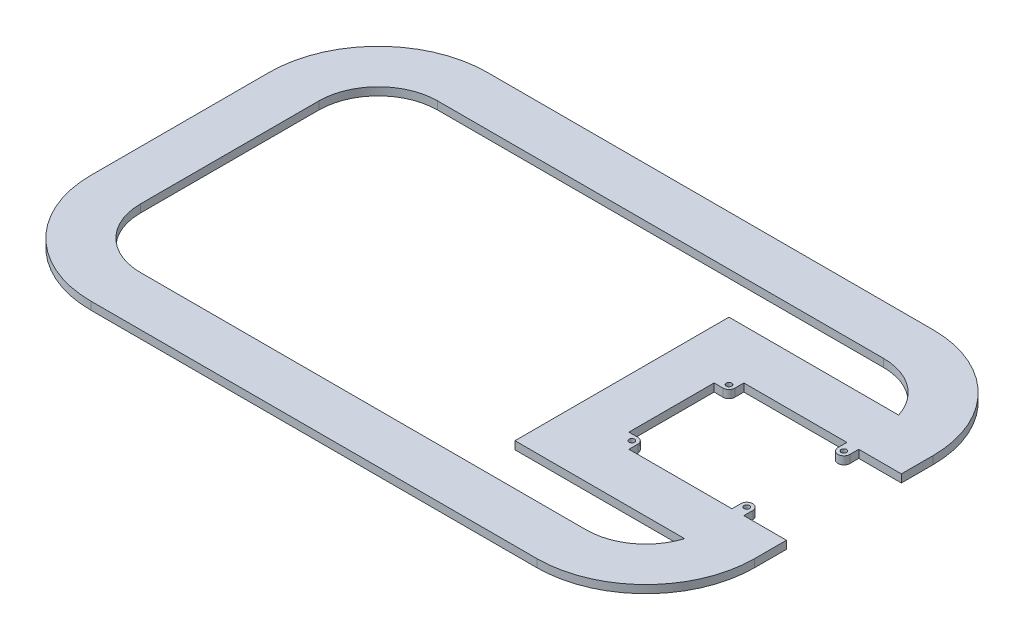
from build123d import *

# Parameters (mm, degrees)
SKETCH1_R           = 1.375
BOSS_EXTRUDE1_DEPTH = 4


with BuildPart() as part:
    # Sketch1 → Boss-Extrude1 (new body)
    with BuildSketch(Plane(origin=(0, 0, 0), x_dir=(1, 0, 0), z_dir=(0, 1, 0))):
        with BuildLine():
            Line((55, 0), (280, 0))
            ThreePointArc((280, 0), (318.890872965, 16.109127035), (335, 55))
            Line((335, 55), (335, 71))
            Line((335, 71), (313.5, 71))
            Line((313.5, 71), (313.5, 75.5))
            ThreePointArc((313.5, 75.5), (310.5, 78.5), (307.5, 75.5))
            Line((307.5, 75.5), (307.5, 71))
            Line((307.5, 71), (255.5, 71))
            Line((255.5, 71), (255.5, 75.5))
            ThreePointArc((255.5, 75.5), (254.621320344, 77.621320344), (252.5, 78.5))
            Line((252.5, 78.5), (248, 78.5))
            Line((248, 78.5), (248, 121.5))
            Line((248, 121.5), (252.5, 121.5))
            ThreePointArc((252.5, 121.5), (254.621320344, 122.378679656), (255.5, 124.5))
            Line((255.5, 124.5), (255.5, 129))
            Line((255.5, 129), (307.5, 129))
            Line((307.5, 129), (307.5, 124.5))
            ThreePointArc((307.5, 124.5), (310.5, 121.5), (313.5, 124.5))
            Line((313.5, 124.5), (313.5, 129))
            Line((313.5, 129), (335, 129))
            Line((335, 129), (335, 145))
            ThreePointArc((335, 145), (318.890872965, 183.890872965), (280, 200))
            Line((280, 200), (55, 200))
            ThreePointArc((55, 200), (16.109127035, 183.890872965), (0, 145))
            Line((0, 145), (0, 55))
            ThreePointArc((0, 55), (16.109127035, 16.109127035), (55, 0))
        make_face()
        with Locations(Location((252.5, 124.5, 0), (0, 0, 270))):
            Circle(SKETCH1_R, mode=Mode.SUBTRACT)
        with Locations(Location((252.5, 75.5, 0), (0, 0, 90))):
            Circle(SKETCH1_R, mode=Mode.SUBTRACT)
        with Locations(Location((310.5, 124.5, 0), (0, 0, 270))):
            Circle(SKETCH1_R, mode=Mode.SUBTRACT)
        with Locations(Location((310.5, 75.5, 0), (0, 0, 90))):
            Circle(SKETCH1_R, mode=Mode.SUBTRACT)
        with BuildLine():
            Line((55, 25), (280, 25))
            ThreePointArc((280, 25), (297.748239349, 30.813226755), (308.618176043, 46))
            Line((308.618176043, 46), (223, 46))
            Line((223, 46), (223, 154))
            Line((223, 154), (308.618176043, 154))
            ThreePointArc((308.618176043, 154), (297.748239349, 169.186773245), (280, 175))
            Line((280, 175), (55, 175))
            ThreePointArc((55, 175), (33.786796564, 166.213203436), (25, 145))
            Line((25, 145), (25, 55))
            ThreePointArc((25, 55), (33.786796564, 33.786796564), (55, 25))
        make_face(mode=Mode.SUBTRACT)
    extrude(amount=BOSS_EXTRUDE1_DEPTH)


solid = part.part
